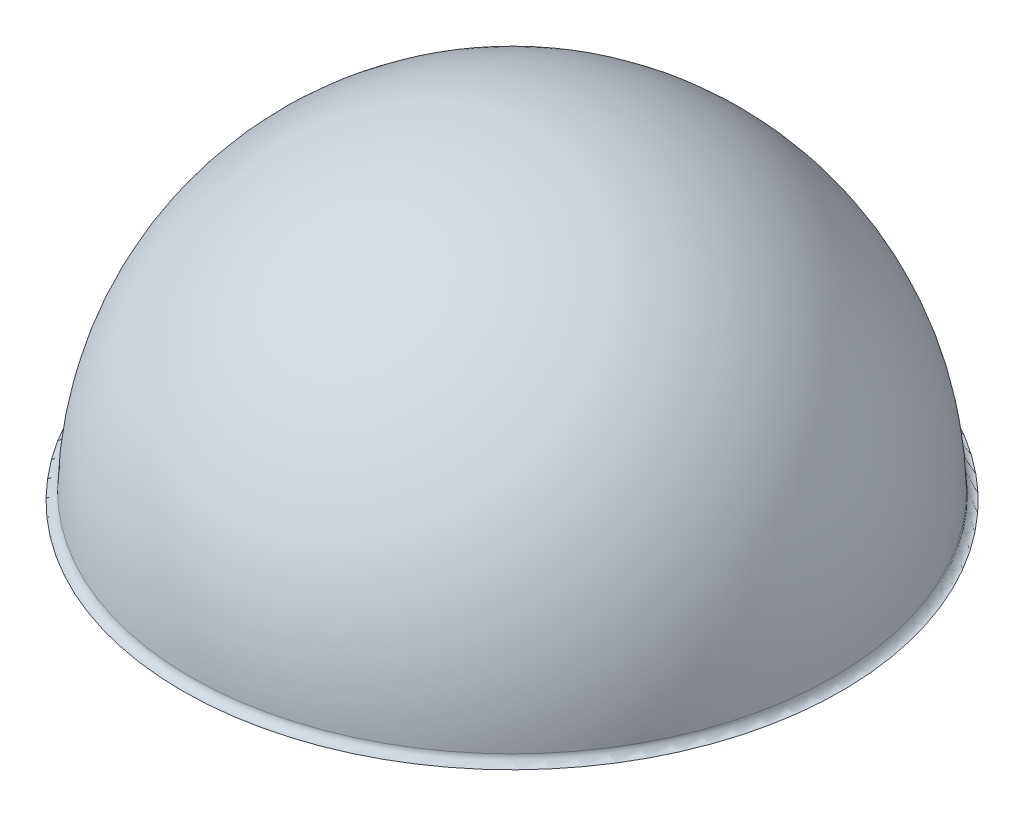
from build123d import *

# Parameters (mm, degrees)
SHELL1_T = -0.1


with BuildPart() as part:
    # Sketch1 → Revolve2 (revolve)
    with BuildSketch(Plane.XY, mode=Mode.PRIVATE) as revolve2_sk:
        with BuildLine():
            Line((1.25, 1.25), (1.25, 0))
            Line((1.25, 0), (2.531549112, 0))
            ThreePointArc((2.531549112, 0), (2.509242253, 0.009077382), (2.499611783, 0.031151097))
            ThreePointArc((2.499611783, 0.031151097), (2.122800415, 0.894829277), (1.25, 1.25))
        make_face()
    revolve(revolve2_sk.sketch.rotate(Axis((1.25, 1.25, 0), (0, -1, 0)), 90), axis=Axis((1.25, 1.25, 0), (0, -1, 0)))

    # Shell1
    shell1_openings = [part.faces().sort_by_distance(p)[0] for p in [
        (1.25, 0, 0),
    ]]
    offset(amount=SHELL1_T, openings=shell1_openings, kind=Kind.INTERSECTION)


solid = part.part
